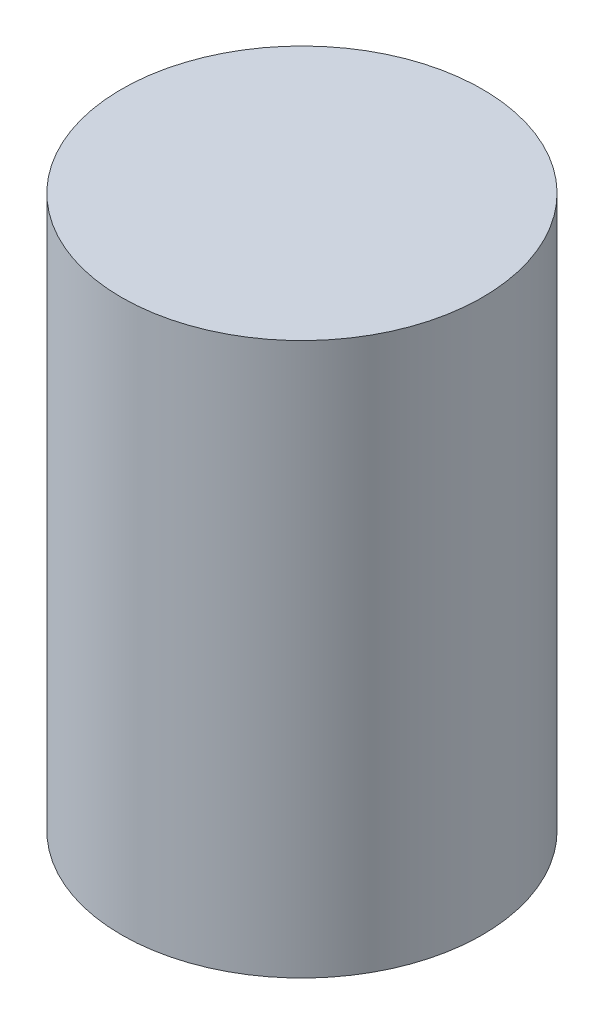
from build123d import *
from build123d.topology import SkipClean

# Parameters (mm, degrees)
SKETCH1_R               = 4.65
BOSS_EXTRUDE1_DEPTH     = 12
SKETCH2_R               = 17.5
BOSS_EXTRUDE2_DEPTH     = 2
SKETCH3_W               = 5
SKETCH3_H               = 13
BOSS_EXTRUDE3_DEPTH     = 12
FILLET1_R               = 4
FILLET2_R               = 4
CUT_EXTRUDE1_DEPTH      = 29.434134416
SKETCH5_R               = 2.05
CUT_EXTRUDE2_DEPTH      = 70
FILLET3_R               = 4
SKETCH6_R               = 24.65
SKETCH6_R_2             = 4.65
CUT_EXTRUDE_THIN1_DEPTH = 25.540782384
SKETCH7_R               = 24.575
SKETCH7_R_2             = 4.575
CUT_EXTRUDE_THIN2_DEPTH = 30


with BuildPart() as part:
    # Sketch1 → Boss-Extrude1 (new body)
    with BuildSketch(Plane(origin=(0, 0, 0), x_dir=(1, 0, 0), z_dir=(0, 1, 0))):
        with Locations(Location((0, 0, 0), (0, 0, 270))):
            Circle(SKETCH1_R)
    extrude(amount=BOSS_EXTRUDE1_DEPTH)

    # Sketch2 → Boss-Extrude2 (add)
    with BuildSketch(Plane(origin=(0, 12, 0), x_dir=(1, 0, 0), z_dir=(0, 1, 0))):
        with Locations(Location((0, 0, 0), (0, 0, 270))):
            Circle(SKETCH2_R)
    extrude(amount=BOSS_EXTRUDE2_DEPTH)

    # Sketch3 → Boss-Extrude3 (add)
    with BuildSketch(Plane(origin=(0, 14, 0), x_dir=(1, 0, 0), z_dir=(0, 1, 0))):
        with Locations((7.5, 0)):
            Rectangle(SKETCH3_W, SKETCH3_H)
    boss_extrude3 = extrude(amount=BOSS_EXTRUDE3_DEPTH)

    # Mirror1: Boss-Extrude3 across plane
    add(boss_extrude3.mirror(Plane(origin=(0, 0, 0), x_dir=(0, 0, 1), z_dir=(1, 0, 0))))

    # Fillet1
    fillet1_edges = [part.edges().sort_by_distance(p)[0] for p in [
        (7.5, 26, -6.5),
        (7.5, 26, 6.5),
        (-7.5, 26, 6.5),
        (-7.5, 26, -6.5),
    ]]
    fillet(fillet1_edges, radius=FILLET1_R)

    # Fillet2
    fillet2_edges = [part.edges().sort_by_distance(p)[0] for p in [
        (7.5, 14, 6.5),
        (7.5, 14, -6.5),
        (-7.5, 14, -6.5),
        (-7.5, 14, 6.5),
    ]]
    fillet(fillet2_edges, radius=FILLET2_R)

    # Sketch4 → Cut-Extrude1 (cut, through all)
    with BuildSketch(Plane(origin=(0, 14, 0), x_dir=(1, 0, 0), z_dir=(0, 1, 0))):
        with BuildLine():
            Line((10, 14.361406616), (10, 0))
            Line((10, 0), (10, -14.361406616))
            ThreePointArc((10, -14.361406616), (15.512092057, -8.100925873), (17.5, 0))
            ThreePointArc((17.5, 0), (15.512092057, 8.100925873), (10, 14.361406616))
        make_face()
    cut_extrude1 = extrude(amount=-CUT_EXTRUDE1_DEPTH, mode=Mode.SUBTRACT)

    # Mirror2: Cut-Extrude1 across plane
    add(cut_extrude1.mirror(Plane(origin=(0, 0, 0), x_dir=(0, 0, 1), z_dir=(1, 0, 0))), mode=Mode.SUBTRACT)

    # Sketch5 → Cut-Extrude2 (cut)
    with BuildSketch(Plane(origin=(10, 0, 0), x_dir=(0, 0, -1), z_dir=(1, 0, 0))):
        with Locations((0, 20)):
            Circle(SKETCH5_R)
    extrude(amount=-CUT_EXTRUDE2_DEPTH, mode=Mode.SUBTRACT)

    # Fillet3
    fillet3_edges = [part.edges().sort_by_distance(p)[0] for p in [
        (10, 13, -14.361406616),
        (10, 13, 14.361406616),
        (-10, 13, 14.361406616),
        (-10, 13, -14.361406616),
    ]]
    fillet(fillet3_edges, radius=FILLET3_R)

    # Sketch6 → Cut-Extrude-Thin1 (cut, through all)
    with SkipClean():  # the faces are left unmerged after this step: merging them gives an invalid solid
        with BuildSketch(Plane.XZ.offset(-12)):
            Circle(SKETCH6_R)
            Circle(SKETCH6_R_2, mode=Mode.SUBTRACT)
        extrude(amount=-CUT_EXTRUDE_THIN1_DEPTH, mode=Mode.SUBTRACT)

    # Sketch7 → Cut-Extrude-Thin2 (cut)
    with BuildSketch(Plane(origin=(0, 14, 0), x_dir=(1, 0, 0), z_dir=(0, 1, 0))):
        Circle(SKETCH7_R)
        Circle(SKETCH7_R_2, mode=Mode.SUBTRACT)
    extrude(amount=-CUT_EXTRUDE_THIN2_DEPTH, mode=Mode.SUBTRACT)


solid = part.part
